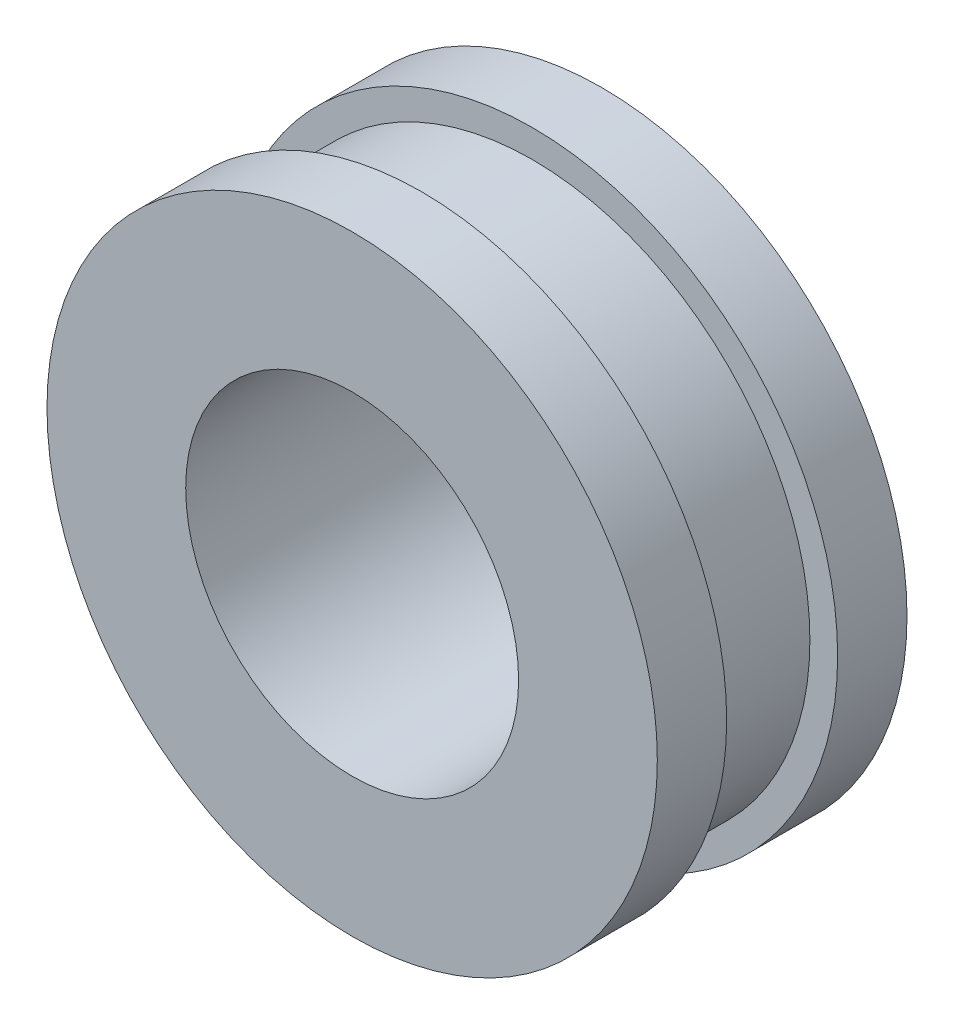
from build123d import *

# Parameters (mm, degrees)
SKETCH_2_R          = 5.5
SKETCH_2_R_2        = 3
EXTRUDE_1_DEPTH     = 2.25
SKETCH_3_OUTSIDE_W  = 16.238
SKETCH_3_OUTSIDE_H  = 16.238
SKETCH_3_OUTSIDE_R  = 5
CUT_EXTRUDE_1_DEPTH = 1


with BuildPart() as part:
    # 草图2 → 凸台-拉伸1 (new, symmetric)
    with BuildSketch(Plane.XY):
        Circle(SKETCH_2_R)
        Circle(SKETCH_2_R_2, mode=Mode.SUBTRACT)
    extrude(amount=EXTRUDE_1_DEPTH, both=True)

    # 草图3 outside → 切除-拉伸1 (cut, symmetric)
    with BuildSketch(Plane.XY):
        Rectangle(SKETCH_3_OUTSIDE_W, SKETCH_3_OUTSIDE_H)
        Circle(SKETCH_3_OUTSIDE_R, mode=Mode.SUBTRACT)
    extrude(amount=CUT_EXTRUDE_1_DEPTH, both=True, mode=Mode.SUBTRACT)


solid = part.part
